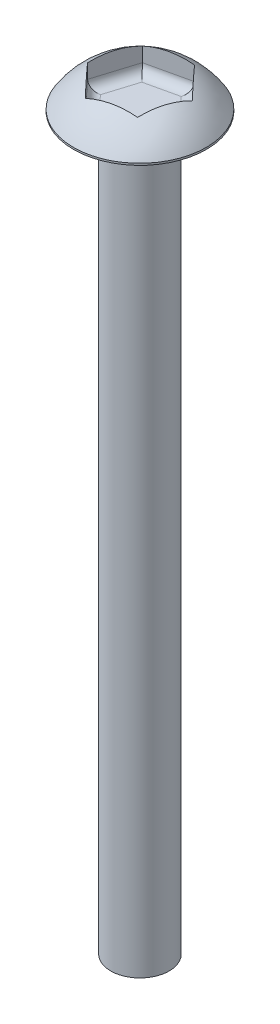
from build123d import *

# Parameters (mm, degrees)
SKETCH1_R           = 4
BOSS_EXTRUDE1_DEPTH = 100
SKETCH2_R           = 9.096563294
BOSS_EXTRUDE2_DEPTH = 0.254
DOME1_FACE_RADIUS   = 9.096563294
DOME1_HEIGHT        = 5.08
CUT_EXTRUDE1_DEPTH  = 102.076008249
FILLET1_R           = 1.27


with BuildPart() as part:
    # Sketch1 → Boss-Extrude1 (new body)
    with BuildSketch(Plane(origin=(0, 0, 0), x_dir=(1, 0, 0), z_dir=(0, 1, 0))):
        with Locations(Location((0, 0, 0), (0, 0, 270))):
            Circle(SKETCH1_R)
    extrude(amount=BOSS_EXTRUDE1_DEPTH)

    # Sketch2 → Boss-Extrude2 (add)
    with BuildSketch(Plane(origin=(0, 100, 0), x_dir=(1, 0, 0), z_dir=(0, 1, 0))):
        with Locations(Location((0, 0, 0), (0, 0, 270))):
            Circle(SKETCH2_R)
    extrude(amount=BOSS_EXTRUDE2_DEPTH)

    # Dome1: a dome of height H over a round flat face of radius A is a cap of a sphere of radius (A * A + H * H) / (2 * H)
    dome1_r = (DOME1_FACE_RADIUS * DOME1_FACE_RADIUS + DOME1_HEIGHT * DOME1_HEIGHT) / (2 * DOME1_HEIGHT)
    dome1_base = Plane((0, 100.254, 0), z_dir=(0, 1, 0))
    with Locations(dome1_base.offset(DOME1_HEIGHT - dome1_r)):
        dome1_ball = Sphere(dome1_r, mode=Mode.PRIVATE)
    add(split(dome1_ball, bisect_by=dome1_base, keep=Keep.TOP, mode=Mode.PRIVATE))

    # Sketch3 → Cut-Extrude1 (cut, through all)
    with BuildSketch(Plane(origin=(0, 100.254, 0), x_dir=(1, 0, 0), z_dir=(0, 1, 0))):
        Polygon((1.770969394, 5.720489675), (-4.068604684, 4.393949322), (-5.839574078, -1.326540353), (-1.770969394, -5.720489675), (4.068604684, -4.393949322), (5.839574078, 1.326540353), align=None)
    extrude(amount=CUT_EXTRUDE1_DEPTH, mode=Mode.SUBTRACT)

    # Fillet1
    fillet1_edges = [part.edges().sort_by_distance(p)[0] for p in [
        (-4.954089381, 100.254, -1.533704485),
        (-3.805271736, 100.254, 3.523515014),
        (1.148817645, 100.254, 5.057219499),
        (4.954089381, 100.254, 1.533704485),
        (3.805271736, 100.254, -3.523515014),
        (-1.148817645, 100.254, -5.057219499),
    ]]
    fillet(fillet1_edges, radius=FILLET1_R)


solid = part.part
